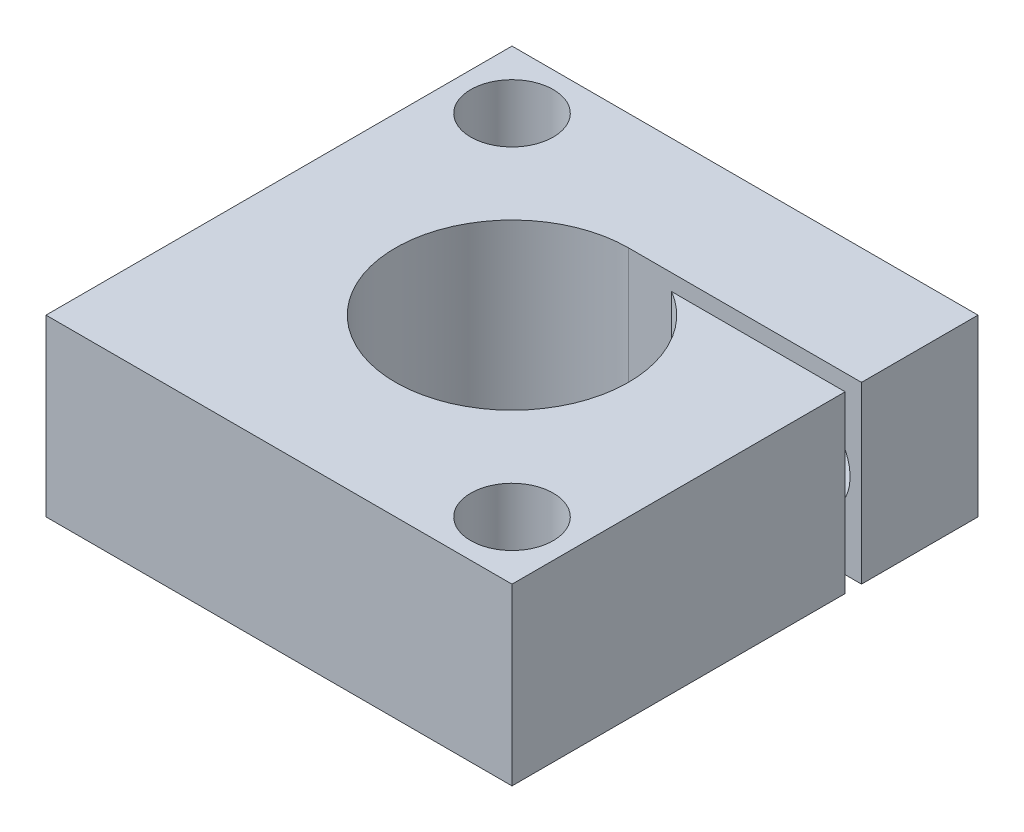
from build123d import *

# Parameters (mm, degrees)
BOSS_EXTRUDE1_DEPTH        = 9.525
F_8_CLEARANCE_HOLE1_D      = 4.4958
F_10_CLEARANCE_HOLE1_D     = 5.1054
F_10_CLEARANCE_HOLE1_DEPTH = 6.35


with BuildPart() as part:
    # Sketch1 → Boss-Extrude1 (new body)
    with BuildSketch(Plane(origin=(0, 0, 0), x_dir=(1, 0, 0), z_dir=(0, 1, 0))):
        with BuildLine():
            Line((1.500621967, 8.481252019), (1.500621967, -9.679747981))
            Line((1.500621967, -9.679747981), (-23.899378033, -9.679747981))
            Line((-23.899378033, -9.679747981), (-23.899378033, 15.720252019))
            Line((-23.899378033, 15.720252019), (1.500621967, 15.720252019))
            Line((1.500621967, 15.720252019), (1.500621967, 9.370252019))
            Line((1.500621967, 9.370252019), (-11.199378033, 9.370252019))
            ThreePointArc((-11.199378033, 9.370252019), (-12.879430115, -3.103466214), (-7.959010924, 8.481252019))
            Line((-7.959010924, 8.481252019), (1.500621967, 8.481252019))
        make_face()
    extrude(amount=BOSS_EXTRUDE1_DEPTH)

    # #8 Clearance Hole1 (through all)
    with Locations(Plane(origin=(0, 9.525, 0), x_dir=(1, 0, 0), z_dir=(0, 1, 0))):
        with Locations((-20.724378033, 12.545252019), (-1.674378033, -6.504747981)):
            Hole(F_8_CLEARANCE_HOLE1_D / 2)

    # Sketch4 → #10-24 Tapped Hole1 (revolve, cut)
    with BuildSketch(Plane(origin=(-1.674378033, 4.7625, -8.481252019), x_dir=(0, 1, 0), z_dir=(1, 0, 0))):
        Polygon((0, 0), (0, 12.316824014), (1.89865, 11.176), (1.89865, 0), align=None)
    revolve(axis=Axis((-1.674378033, 4.7625, -14.831252019), (0, 0, 1)), mode=Mode.SUBTRACT)

    # #10 Clearance Hole1
    with Locations(Plane(origin=(0, 0, -15.720252019), x_dir=(-1, 0, 0), z_dir=(0, 0, -1))):
        with Locations((1.674378033, 4.7625)):
            Hole(F_10_CLEARANCE_HOLE1_D / 2, depth=F_10_CLEARANCE_HOLE1_DEPTH)


solid = part.part
